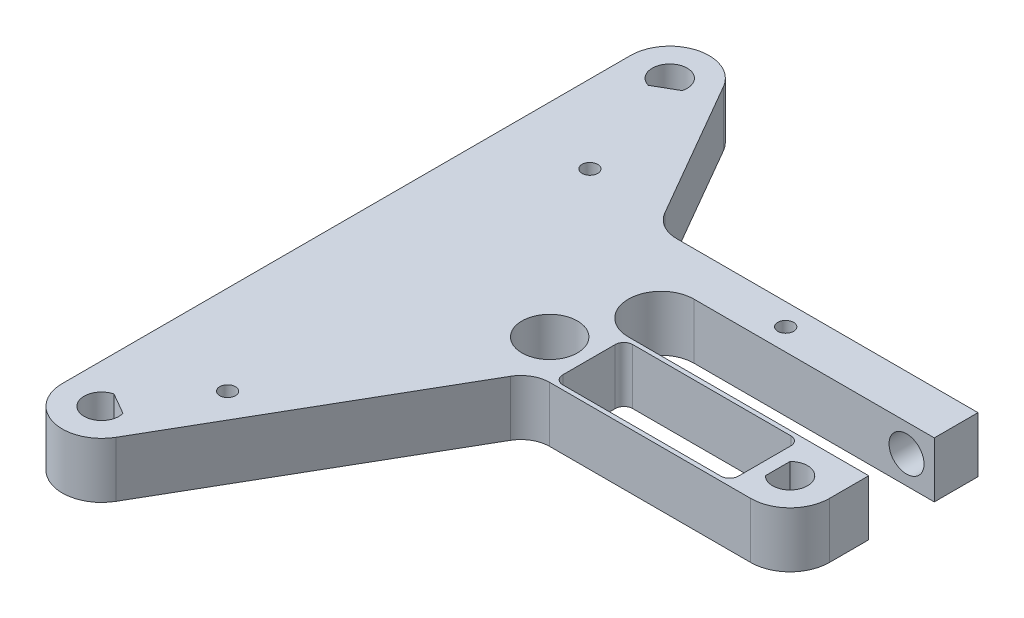
from build123d import *

# Parameters (mm, degrees)
SKETCH1_R           = 6.35
SKETCH1_R_2         = 1.8
SKETCH1_W           = 40.171572875
SKETCH1_H           = 16
BOSS_EXTRUDE1_DEPTH = 12.7
FILLET1_R           = 2
CUT_EXTRUDE1_REACH  = 128.18
SKETCH2_R           = 4


with BuildPart() as part:
    # Sketch1 → Boss-Extrude1 (new body)
    with BuildSketch(Plane(origin=(0, 0, 0), x_dir=(1, 0, 0), z_dir=(0, 1, 0))):
        with BuildLine():
            Line((64, 0), (64, 9))
            Line((64, 9), (9, 9))
            ThreePointArc((9, 9), (1.5, 16.5), (9, 24))
            Line((9, 24), (64, 24))
            Line((64, 24), (64, 34))
            Line((64, 34), (-4.907477288, 34))
            ThreePointArc((-4.907477288, 34), (-8.657477288, 35.004809472), (-11.402667816, 37.75))
            Line((-11.402667816, 37.75), (-29.733538863, 69.5))
            ThreePointArc((-29.733538863, 69.5), (-39.857138903, 73.693332437), (-46.527767497, 65))
            Line((-46.527767497, 65), (-46.527767497, -65))
            ThreePointArc((-46.527767497, -65), (-39.857138903, -73.693332437), (-29.733538863, -69.5))
            Line((-29.733538863, -69.5), (3.294228634, -12.294228634))
            ThreePointArc((3.294228634, -12.294228634), (5.705771366, -9.882685902), (9, -9))
            Line((9, -9), (55, -9))
            ThreePointArc((55, -9), (61.363961031, -6.363961031), (64, 0))
        make_face()
        with Locations(Location((0, 0, 0), (0, 0, 270))):
            Circle(SKETCH1_R, mode=Mode.SUBTRACT)
        with Locations(Location((25, 29, 0), (0, 0, 270))):
            Circle(SKETCH1_R_2, mode=Mode.SUBTRACT)
        with Locations(Location((-28.7, 37.9, 0), (0, 0, 270))):
            Circle(SKETCH1_R_2, mode=Mode.SUBTRACT)
        with Locations(Location((-26.1, -47.6, 0), (0, 0, 270))):
            Circle(SKETCH1_R_2, mode=Mode.SUBTRACT)
        with BuildLine():
            Line((52.171572875, 2.828427125), (52.171572875, -2.828427125))
            ThreePointArc((52.171572875, -2.828427125), (59, 0), (52.171572875, 2.828427125))
        make_face(mode=Mode.SUBTRACT)
        with BuildLine():
            Line((-38.563043678, 61.136296695), (-33.664064192, 63.96472382))
            ThreePointArc((-33.664064192, 63.96472382), (-39.527767497, 68.464101615), (-38.563043678, 61.136296695))
        make_face(mode=Mode.SUBTRACT)
        with BuildLine():
            Line((-38.563043678, -61.136296695), (-33.664064192, -63.96472382))
            ThreePointArc((-33.664064192, -63.96472382), (-39.527767497, -68.464101615), (-38.563043678, -61.136296695))
        make_face(mode=Mode.SUBTRACT)
        with Locations((29.085786438, 0)):
            Rectangle(SKETCH1_W, SKETCH1_H, mode=Mode.SUBTRACT)
    extrude(amount=BOSS_EXTRUDE1_DEPTH)

    # Fillet1
    fillet1_edges = [part.edges().sort_by_distance(p)[0] for p in [
        (9, 6.35, -8),
        (9, 6.35, 8),
        (49.171572875, 6.35, 8),
        (49.171572875, 6.35, -8),
    ]]
    fillet(fillet1_edges, radius=FILLET1_R)

    # Sketch2 → Cut-Extrude1 (cut, up to next)
    with BuildSketch(Plane(origin=(0, 0, -34), x_dir=(-1, 0, 0), z_dir=(0, 0, -1)), mode=Mode.PRIVATE) as cut_extrude1_sk1:
        with Locations((-57.65, 6.35)):
            Circle(SKETCH2_R)
    cut_extrude1_tool1 = extrude(cut_extrude1_sk1.sketch, amount=-CUT_EXTRUDE1_REACH, mode=Mode.PRIVATE) & part.part
    add(cut_extrude1_tool1.solids().sort_by_distance((57.65, 6.35, -34))[0], mode=Mode.SUBTRACT)


solid = part.part
